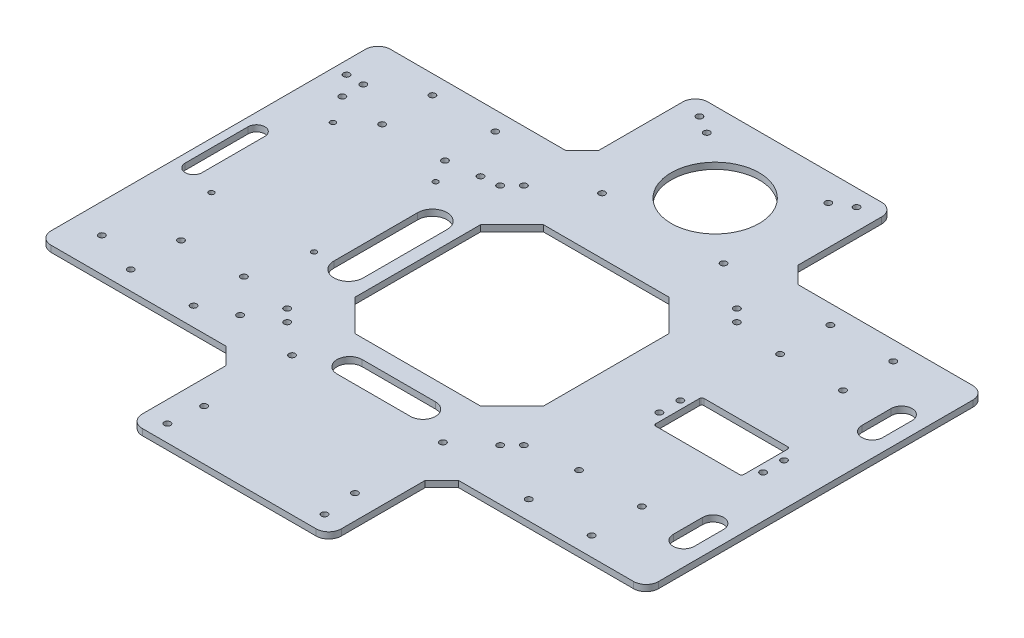
from build123d import *

# Parameters (mm, degrees)
EXTRUDE_1_DEPTH      = 3
SKETCH_2_R           = 1.5
CUT_EXTRUDE_1_DEPTH  = 3
SKETCH_3_R           = 21
SKETCH_3_R_2         = 1.5
CUT_EXTRUDE_2_DEPTH  = 10
SKETCH_4_W           = 90
SKETCH_4_H           = 90
CUT_EXTRUDE_3_DEPTH  = 3
FILLET_3_R           = 6
CHAMFER_1_SIZE       = 8
CUT_EXTRUDE_6_DEPTH  = 10
CHAMFER_2_SIZE       = 15
SKETCH_8_R           = 1.5
CUT_EXTRUDE_7_DEPTH  = 10
SKETCH_9_R           = 1.5
CUT_EXTRUDE_8_DEPTH  = 10
CUT_EXTRUDE_9_DEPTH  = 10
SKETCH_14_R          = 1.5
CUT_EXTRUDE_10_DEPTH = 10
SKETCH_15_R          = 1.5
SKETCH_15_W          = 42
SKETCH_15_H          = 23
CUT_EXTRUDE_11_DEPTH = 10
FILLET_4_R           = 1
SKETCH_16_R          = 1.25
CUT_EXTRUDE_12_DEPTH = 10
SKETCH_19_R          = 1.5
CUT_EXTRUDE_13_DEPTH = 10


with BuildPart() as part:
    # 草图1 → 凸台-拉伸1 (new body)
    with BuildSketch(Plane(origin=(0, 0, 0), x_dir=(1, 0, 0), z_dir=(0, 1, 0))):
        Polygon((-47.5, -81), (-47.5, -135), (47.5, -135), (47.5, -81), (145, -81), (145, 81), (47.5, 81), (47.5, 135), (-47.5, 135), (-47.5, 81), (-145, 81), (-145, -81), align=None)
    extrude(amount=EXTRUDE_1_DEPTH)

    # 草图2 → 切除-拉伸1 (cut)
    with BuildSketch(Plane(origin=(0, 3, 0), x_dir=(1, 0, 0), z_dir=(0, 1, 0))):
        with Locations(Location((110, 72, 0), (0, 0, 270))):
            Circle(SKETCH_2_R)
        with Locations(Location((80, 72, 0), (0, 0, 270))):
            Circle(SKETCH_2_R)
        with Locations(Location((80, 48, 0), (0, 0, 270))):
            Circle(SKETCH_2_R)
        with Locations(Location((110, 48, 0), (0, 0, 270))):
            Circle(SKETCH_2_R)
        with Locations(Location((110, -48, 0), (0, 0, 90))):
            Circle(SKETCH_2_R)
        with Locations(Location((110, -72, 0), (0, 0, 90))):
            Circle(SKETCH_2_R)
        with Locations(Location((80, -48, 0), (0, 0, 90))):
            Circle(SKETCH_2_R)
        with Locations(Location((80, -72, 0), (0, 0, 90))):
            Circle(SKETCH_2_R)
        with Locations(Location((-80, -72, 0), (0, 0, 270))):
            Circle(SKETCH_2_R)
        with Locations(Location((-80, -48, 0), (0, 0, 270))):
            Circle(SKETCH_2_R)
        with Locations(Location((-110, -72, 0), (0, 0, 270))):
            Circle(SKETCH_2_R)
        with Locations(Location((-110, -48, 0), (0, 0, 270))):
            Circle(SKETCH_2_R)
        with Locations(Location((-110, 48, 0), (0, 0, 90))):
            Circle(SKETCH_2_R)
        with Locations(Location((-80, 48, 0), (0, 0, 90))):
            Circle(SKETCH_2_R)
        with Locations(Location((-80, 72, 0), (0, 0, 90))):
            Circle(SKETCH_2_R)
        with Locations(Location((-110, 72, 0), (0, 0, 90))):
            Circle(SKETCH_2_R)
    extrude(amount=-CUT_EXTRUDE_1_DEPTH, mode=Mode.SUBTRACT)

    # 草图3 → 切除-拉伸2 (cut)
    with BuildSketch(Plane(origin=(0, 3, 0), x_dir=(1, 0, 0), z_dir=(0, 1, 0))):
        with Locations(Location((0, 97, 0), (0, 0, 270))):
            Circle(SKETCH_3_R)
        with Locations(Location((29, 122, 0), (0, 0, 270))):
            Circle(SKETCH_3_R_2)
        with Locations(Location((29, 72, 0), (0, 0, 270))):
            Circle(SKETCH_3_R_2)
        with Locations(Location((-29, 72, 0), (0, 0, 270))):
            Circle(SKETCH_3_R_2)
        with Locations(Location((-29, 122, 0), (0, 0, 270))):
            Circle(SKETCH_3_R_2)
    extrude(amount=-CUT_EXTRUDE_2_DEPTH, mode=Mode.SUBTRACT)

    # 草图4 → 切除-拉伸3 (cut)
    with BuildSketch(Plane(origin=(0, 3, 0), x_dir=(1, 0, 0), z_dir=(0, 1, 0))):
        Rectangle(SKETCH_4_W, SKETCH_4_H)
    extrude(amount=-CUT_EXTRUDE_3_DEPTH, mode=Mode.SUBTRACT)

    # 圆角3
    fillet_3_edges = [part.edges().sort_by_distance(p)[0] for p in [
        (-145, 1.5, 81),
        (-145, 1.5, -81),
        (-47.5, 1.5, -135),
        (47.5, 1.5, -135),
        (145, 1.5, -81),
        (145, 1.5, 81),
        (47.5, 1.5, 135),
        (-47.5, 1.5, 135),
    ]]
    fillet(fillet_3_edges, radius=FILLET_3_R)

    # 倒角1
    chamfer_1_edges = [part.edges().sort_by_distance(p)[0] for p in [
        (-47.5, 1.5, 81),
        (-47.5, 1.5, -81),
        (47.5, 1.5, -81),
        (47.5, 1.5, 81),
    ]]
    chamfer(chamfer_1_edges, length=CHAMFER_1_SIZE)

    # 草图7 → 切除-拉伸6 (cut)
    with BuildSketch(Plane(origin=(0, 3, 0), x_dir=(1, 0, 0), z_dir=(0, 1, 0))):
        with BuildLine():
            Line((-65, -20), (-65, 20))
            ThreePointArc((-65, 20), (-58, 27), (-51, 20))
            Line((-51, 20), (-51, -20))
            ThreePointArc((-51, -20), (-58, -27), (-65, -20))
        make_face()
        with BuildLine():
            Line((-141, -15), (-141, 15))
            ThreePointArc((-141, 15), (-137, 19), (-133, 15))
            Line((-133, 15), (-133, -15))
            ThreePointArc((-133, -15), (-137, -19), (-141, -15))
        make_face()
        with BuildLine():
            Line((129, 38), (129, 52))
            ThreePointArc((129, 52), (134, 57), (139, 52))
            Line((139, 52), (139, 38))
            ThreePointArc((139, 38), (134, 33), (129, 38))
        make_face()
        with BuildLine():
            Line((129, -38), (129, -52))
            ThreePointArc((129, -52), (134, -57), (139, -52))
            Line((139, -52), (139, -38))
            ThreePointArc((139, -38), (134, -33), (129, -38))
        make_face()
    extrude(amount=-CUT_EXTRUDE_6_DEPTH, mode=Mode.SUBTRACT)

    # 倒角2
    chamfer_2_edges = [part.edges().sort_by_distance(p)[0] for p in [
        (45, 1.5, -45),
        (45, 1.5, 45),
        (-45, 1.5, 45),
        (-45, 1.5, -45),
    ]]
    chamfer(chamfer_2_edges, length=CHAMFER_2_SIZE)

    # 草图8 → 切除-拉伸7 (cut)
    with BuildSketch(Plane(origin=(0, 3, 0), x_dir=(1, 0, 0), z_dir=(0, 1, 0))):
        with Locations(Location((-139, 60, 0), (0, 0, 270))):
            Circle(SKETCH_8_R)
        with Locations(Location((-131, 60, 0), (0, 0, 270))):
            Circle(SKETCH_8_R)
    extrude(amount=-CUT_EXTRUDE_7_DEPTH, mode=Mode.SUBTRACT)

    # 草图9 → 切除-拉伸8 (cut)
    with BuildSketch(Plane(origin=(0, 3, 0), x_dir=(1, 0, 0), z_dir=(0, 1, 0))):
        with Locations(Location((50.843145751, 56.5, 0), (0, 0, 270))):
            Circle(SKETCH_9_R)
        with Locations(Location((56.5, 50.843145751, 0), (0, 0, 270))):
            Circle(SKETCH_9_R)
        with Locations(Location((56.5, -50.843145751, 0), (0, 0, 270))):
            Circle(SKETCH_9_R)
        with Locations(Location((50.843145751, -56.5, 0), (0, 0, 270))):
            Circle(SKETCH_9_R)
        with Locations(Location((-50.843145751, -56.5, 0), (0, 0, 270))):
            Circle(SKETCH_9_R)
        with Locations(Location((-56.5, -50.843145751, 0), (0, 0, 270))):
            Circle(SKETCH_9_R)
        with Locations(Location((-56.5, 50.843145751, 0), (0, 0, 270))):
            Circle(SKETCH_9_R)
        with Locations(Location((-50.843145751, 56.5, 0), (0, 0, 270))):
            Circle(SKETCH_9_R)
        with Locations(Location((-37.5, -127, 0), (0, 0, 270))):
            Circle(SKETCH_9_R)
        with Locations(Location((37.5, -127, 0), (0, 0, 270))):
            Circle(SKETCH_9_R)
        with Locations(Location((37.5, 127, 0), (0, 0, 270))):
            Circle(SKETCH_9_R)
        with Locations(Location((-37.5, 127, 0), (0, 0, 270))):
            Circle(SKETCH_9_R)
    extrude(amount=-CUT_EXTRUDE_8_DEPTH, mode=Mode.SUBTRACT)

    # 草图12 → 切除-拉伸9 (cut)
    with BuildSketch(Plane(origin=(0, 3, 0), x_dir=(1, 0, 0), z_dir=(0, 1, 0))):
        with BuildLine():
            Line((-17.5, -54), (17.5, -54))
            ThreePointArc((17.5, -54), (23.5, -60), (17.5, -66))
            Line((17.5, -66), (-17.5, -66))
            ThreePointArc((-17.5, -66), (-23.5, -60), (-17.5, -54))
        make_face()
    extrude(amount=-CUT_EXTRUDE_9_DEPTH, mode=Mode.SUBTRACT)

    # 草图14 → 切除-拉伸10 (cut)
    with BuildSketch(Plane(origin=(0, 3, 0), x_dir=(1, 0, 0), z_dir=(0, 1, 0))):
        with Locations(Location((36, -69, 0), (0, 0, 270))):
            Circle(SKETCH_14_R)
        with Locations(Location((36, -111, 0), (0, 0, 270))):
            Circle(SKETCH_14_R)
        with Locations(Location((-36, -111, 0), (0, 0, 270))):
            Circle(SKETCH_14_R)
        with Locations(Location((-36, -69, 0), (0, 0, 270))):
            Circle(SKETCH_14_R)
    extrude(amount=-CUT_EXTRUDE_10_DEPTH, mode=Mode.SUBTRACT)

    # 草图15 → 切除-拉伸11 (cut)
    with BuildSketch(Plane(origin=(0, 3, 0), x_dir=(1, 0, 0), z_dir=(0, 1, 0))):
        with Locations(Location((75.36, 5, 0), (0, 0, 270))):
            Circle(SKETCH_15_R)
        with Locations(Location((75.36, -5, 0), (0, 0, 270))):
            Circle(SKETCH_15_R)
        with Locations(Location((124.86, -5, 0), (0, 0, 270))):
            Circle(SKETCH_15_R)
        with Locations(Location((124.86, 5, 0), (0, 0, 270))):
            Circle(SKETCH_15_R)
        with Locations((100.11, 0)):
            Rectangle(SKETCH_15_W, SKETCH_15_H)
    extrude(amount=-CUT_EXTRUDE_11_DEPTH, mode=Mode.SUBTRACT)

    # 圆角4
    fillet_4_edges = [part.edges().sort_by_distance(p)[0] for p in [
        (121.11, 1.5, -11.5),
        (121.11, 1.5, 11.5),
        (79.11, 1.5, 11.5),
        (79.11, 1.5, -11.5),
    ]]
    fillet(fillet_4_edges, radius=FILLET_4_R)

    # 草图16 → 切除-拉伸12 (cut)
    with BuildSketch(Plane(origin=(0, 3, 0), x_dir=(1, 0, 0), z_dir=(0, 1, 0))):
        with Locations(Location((-73.5, 37, 0), (0, 0, 270))):
            Circle(SKETCH_16_R)
        with Locations(Location((-122.5, 37, 0), (0, 0, 270))):
            Circle(SKETCH_16_R)
        with Locations(Location((-73.5, -21, 0), (0, 0, 270))):
            Circle(SKETCH_16_R)
        with Locations(Location((-122.5, -21, 0), (0, 0, 270))):
            Circle(SKETCH_16_R)
    extrude(amount=-CUT_EXTRUDE_12_DEPTH, mode=Mode.SUBTRACT)

    # 草图19 → 切除-拉伸13 (cut)
    with BuildSketch(Plane(origin=(0, 3, 0), x_dir=(1, 0, 0), z_dir=(0, 1, 0))):
        with Locations(Location((-65, 50, 0), (0, 0, 270))):
            Circle(SKETCH_19_R)
        with Locations(Location((-131, 50, 0), (0, 0, 270))):
            Circle(SKETCH_19_R)
        with Locations(Location((-65, -64.8, 0), (0, 0, 270))):
            Circle(SKETCH_19_R)
        with Locations(Location((-131, -64.8, 0), (0, 0, 270))):
            Circle(SKETCH_19_R)
    extrude(amount=-CUT_EXTRUDE_13_DEPTH, mode=Mode.SUBTRACT)


solid = part.part
